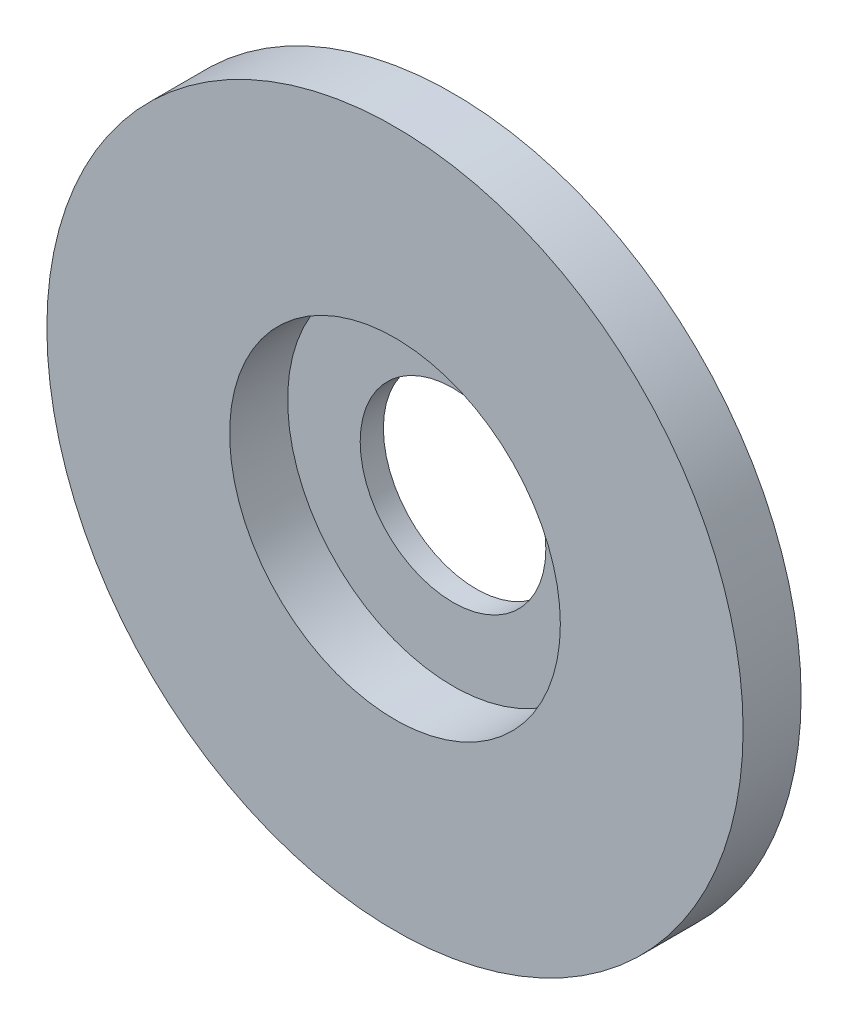
from build123d import *
from build123d.topology import SkipClean

# Parameters (mm, degrees)
SKETCH2_R           = 30
SKETCH2_R_2         = 8
BOSS_EXTRUDE1_DEPTH = 2
SKETCH3_R           = 30
SKETCH3_R_2         = 14.25
BOSS_EXTRUDE2_DEPTH = 5
CUT_EXTRUDE1_START  = -1
SKETCH5_R           = 14.25
SKETCH5_R_2         = 8
CUT_EXTRUDE1_DEPTH  = 1
SKETCH7_R           = 30
SKETCH7_R_2         = 14.25
BOSS_EXTRUDE4_DEPTH = 1
CUT_EXTRUDE3_START  = -2
SKETCH8_R           = 30
SKETCH8_R_2         = 14.25
CUT_EXTRUDE3_DEPTH  = 2
BOSS_EXTRUDE6_START = 1
SKETCH10_R          = 20
SKETCH10_R_2        = 8
BOSS_EXTRUDE6_DEPTH = 1
SKETCH11_R          = 30
SKETCH11_R_2        = 20
CUT_EXTRUDE4_DEPTH  = 1


with BuildPart() as part:
    # Sketch2 → Boss-Extrude1 (new body)
    with BuildSketch(Plane.XY):
        Circle(SKETCH2_R)
        Circle(SKETCH2_R_2, mode=Mode.SUBTRACT)
    extrude(amount=BOSS_EXTRUDE1_DEPTH)

    # Sketch3 → Boss-Extrude2 (add)
    with BuildSketch(Plane.XY.offset(2)):
        Circle(SKETCH3_R)
        Circle(SKETCH3_R_2, mode=Mode.SUBTRACT)
    extrude(amount=BOSS_EXTRUDE2_DEPTH)

    # Sketch5 → Cut-Extrude1 (cut)
    with BuildSketch(Plane.XY.offset(2).offset(CUT_EXTRUDE1_START)):
        Circle(SKETCH5_R)
        Circle(SKETCH5_R_2, mode=Mode.SUBTRACT)
    extrude(amount=CUT_EXTRUDE1_DEPTH, mode=Mode.SUBTRACT)

    # Sketch7 → Boss-Extrude4 (add)
    with BuildSketch(Plane.XY.offset(7)):
        Circle(SKETCH7_R)
        Circle(SKETCH7_R_2, mode=Mode.SUBTRACT)
    extrude(amount=BOSS_EXTRUDE4_DEPTH)

    # Sketch8 → Cut-Extrude3 (cut)
    with BuildSketch(Plane.XY.offset(8).offset(CUT_EXTRUDE3_START)):
        Circle(SKETCH8_R)
        Circle(SKETCH8_R_2, mode=Mode.SUBTRACT)
    extrude(amount=CUT_EXTRUDE3_DEPTH, mode=Mode.SUBTRACT)

    # Sketch10 → Boss-Extrude6 (add)
    with SkipClean():  # the faces are left unmerged after this step: merging them gives an invalid solid
        with BuildSketch(Plane(origin=(0, 0, 0), x_dir=(-1, 0, 0), z_dir=(0, 0, -1)).offset(BOSS_EXTRUDE6_START)):
            with Locations(Location((0, 0, 0), (0, 0, 180))):
                Circle(SKETCH10_R)
            Circle(SKETCH10_R_2, mode=Mode.SUBTRACT)
        extrude(amount=-BOSS_EXTRUDE6_DEPTH)

    # Sketch11 → Cut-Extrude4 (cut)
    with BuildSketch(Plane(origin=(0, 0, 0), x_dir=(-1, 0, 0), z_dir=(0, 0, -1))):
        Circle(SKETCH11_R)
        Circle(SKETCH11_R_2, mode=Mode.SUBTRACT)
    extrude(amount=-CUT_EXTRUDE4_DEPTH, mode=Mode.SUBTRACT)


solid = part.part
